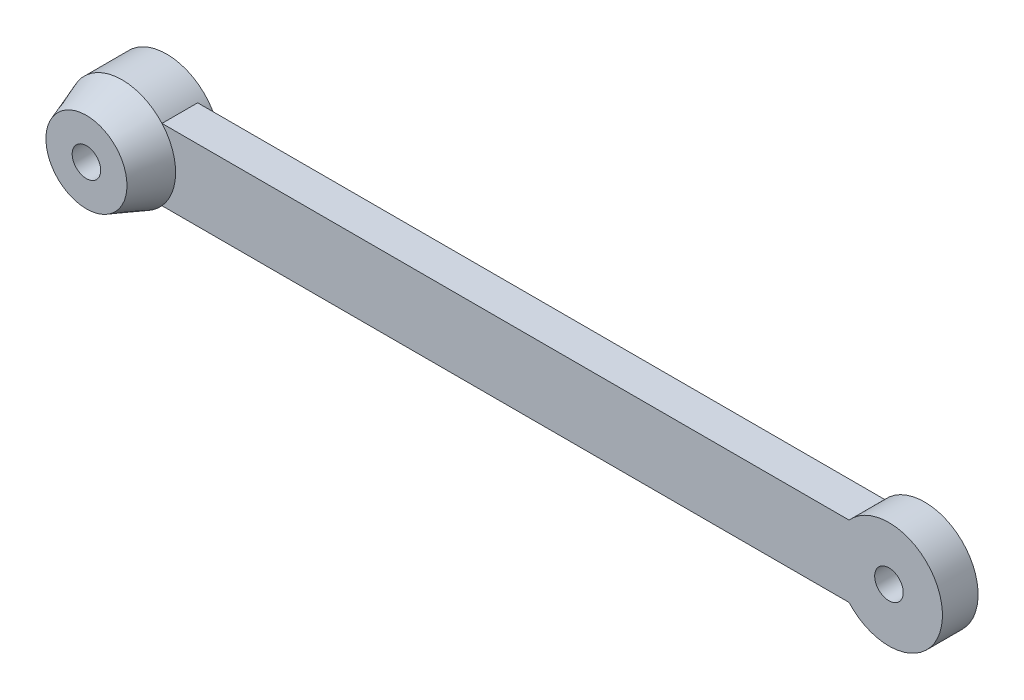
from build123d import *

# Parameters (mm, degrees)
SKETCH1_R             = 15
BOSS_EXTRUDE1_DEPTH   = 10
BOSS_EXTRUDE1_2_DEPTH = 10
SKETCH2_R             = 15
BOSS_EXTRUDE2_DEPTH   = 10
BOSS_EXTRUDE2_TAPER   = 20
BOSS_EXTRUDE3_DEPTH   = 5
BOSS_EXTRUDE4_DEPTH   = 5
SKETCH13_R            = 4
CUT_EXTRUDE1_DEPTH    = 20
BOSS_EXTRUDE7_START   = 2.5
SKETCH14_R            = 15
SKETCH14_R_2          = 4
BOSS_EXTRUDE7_DEPTH   = 2.5


with BuildPart() as part:
    # Sketch1 → Boss-Extrude1 (new body)
    with BuildSketch(Plane.XY):
        Circle(SKETCH1_R)
    extrude(amount=BOSS_EXTRUDE1_DEPTH)

    # Sketch2 → Boss-Extrude2 (add)
    with BuildSketch(Plane.XY.offset(10)):
        Circle(SKETCH2_R)
    extrude(amount=BOSS_EXTRUDE2_DEPTH, taper=BOSS_EXTRUDE2_TAPER)



with BuildPart() as body_2:
    # Sketch1 → Boss-Extrude1 2 (new body)
    with BuildSketch(Plane.XY):
        with Locations((215, 0)):
            Circle(SKETCH1_R)
    extrude(amount=BOSS_EXTRUDE1_2_DEPTH)


with BuildPart() as part_1:
    add(part.part)

    add(body_2.part)  # Boss-Extrude3 merges body 2
    # Sketch5 → Boss-Extrude3 (add)
    with BuildSketch(Plane.XY):
        with BuildLine():
            Line((203.819660113, 10), (11.180339887, 10))
            ThreePointArc((11.180339887, 10), (14.012585384, 5.352331347), (15, 0))
            ThreePointArc((15, 0), (14.012585384, -5.352331347), (11.180339887, -10))
            Line((11.180339887, -10), (203.819660113, -10))
            ThreePointArc((203.819660113, -10), (200, 0), (203.819660113, 10))
        make_face()
    extrude(amount=BOSS_EXTRUDE3_DEPTH)

    # Sketch6 → Boss-Extrude4 (add)
    with BuildSketch(Plane.XY.offset(5)):
        with BuildLine():
            ThreePointArc((15, 0), (14.947457842, -1.254393904), (14.790199458, -2.5))
            ThreePointArc((14.790199458, -2.5), (13.515906498, -6.505403256), (11.180339887, -10))
            Line((11.180339887, -10), (203.819660113, -10))
            ThreePointArc((203.819660113, -10), (200, 0), (203.819660113, 10))
            Line((203.819660113, 10), (11.180339887, 10))
            ThreePointArc((11.180339887, 10), (13.515906498, 6.505403256), (14.790199458, 2.5))
            ThreePointArc((14.790199458, 2.5), (14.947457842, 1.254393904), (15, 0))
        make_face()
    extrude(amount=BOSS_EXTRUDE4_DEPTH)

    # Sketch13 → Cut-Extrude1 (cut)
    with BuildSketch(Plane(origin=(0, 0, 0), x_dir=(-1, 0, 0), z_dir=(0, 0, -1))):
        with Locations((-215, 0)):
            Circle(SKETCH13_R)
        Circle(SKETCH13_R)
    extrude(amount=-CUT_EXTRUDE1_DEPTH, mode=Mode.SUBTRACT)

    # Sketch14 → Boss-Extrude7 (add)
    with BuildSketch(Plane(origin=(0, 0, 0), x_dir=(-1, 0, 0), z_dir=(0, 0, -1)).offset(BOSS_EXTRUDE7_START)):
        Circle(SKETCH14_R)
        Circle(SKETCH14_R_2, mode=Mode.SUBTRACT)
    extrude(amount=-BOSS_EXTRUDE7_DEPTH)


solid = part_1.part
